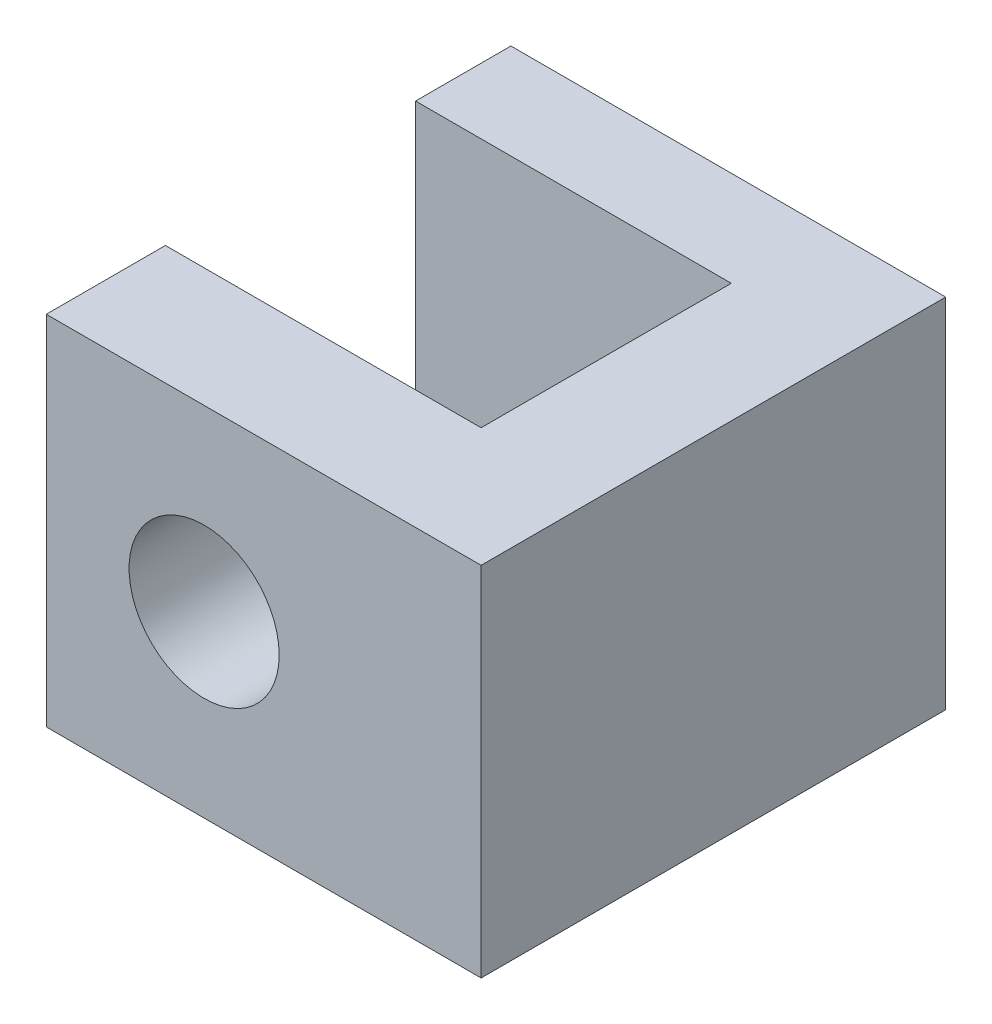
from build123d import *

# Parameters (mm, degrees)
BOSS_EXTRUDE2_DEPTH = 7.5
SKETCH6_R           = 3.15
CUT_EXTRUDE1_DEPTH  = 10
SKETCH8_R           = 2.95
BOSS_EXTRUDE3_DEPTH = 2.9


with BuildPart() as part:
    # Sketch1 → Boss-Extrude2 (new, symmetric)
    with BuildSketch(Plane(origin=(0, 0, 0), x_dir=(1, 0, 0), z_dir=(0, 1, 0))):
        Polygon((-0.75, 0), (17.5, 0), (17.5, 19.5), (-0.75, 19.5), (-0.75, 15.5), (12.5, 15.5), (12.5, 5), (6.25, 5), (-0.75, 5), align=None)
    extrude(amount=BOSS_EXTRUDE2_DEPTH, both=True)

    # Sketch6 → Cut-Extrude1 (cut)
    with BuildSketch(Plane.XY):
        with Locations((5.875, 0)):
            Circle(SKETCH6_R)
    extrude(amount=-CUT_EXTRUDE1_DEPTH, mode=Mode.SUBTRACT)

    # Sketch8 → Boss-Extrude3 (add)
    with BuildSketch(Plane(origin=(0, 0, -19.5), x_dir=(-1, 0, 0), z_dir=(0, 0, -1))):
        with Locations(Location((-5.875, 0, 0), (0, 0, 180))):
            Circle(SKETCH8_R)
    extrude(amount=BOSS_EXTRUDE3_DEPTH)


solid = part.part
